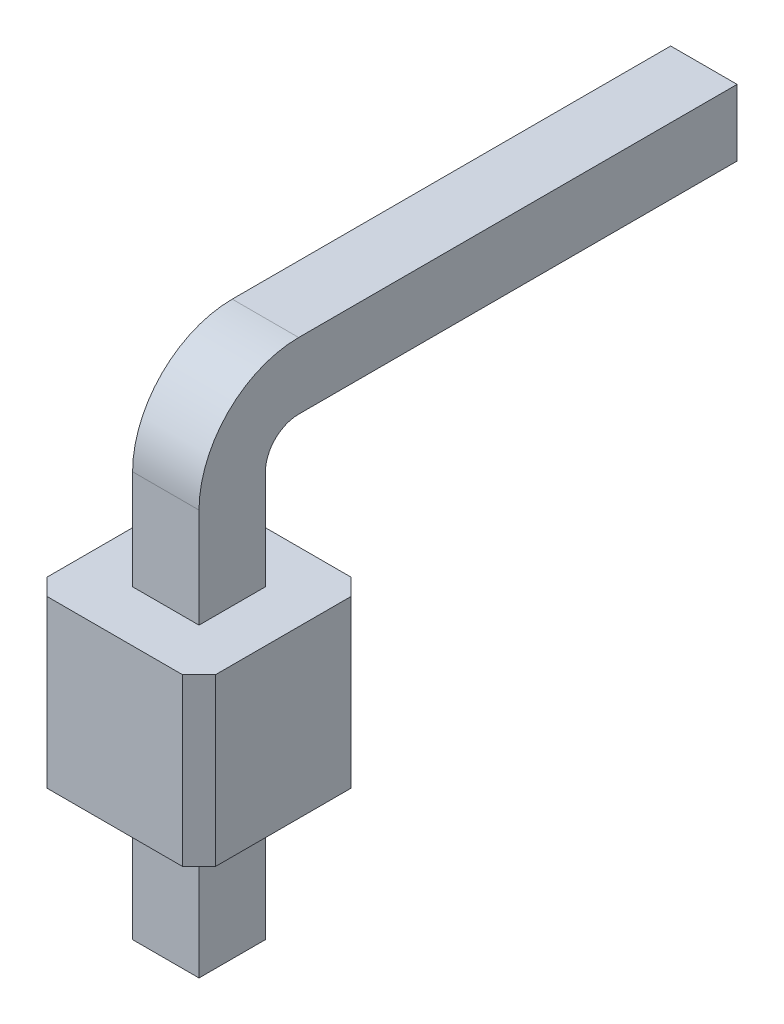
from build123d import *

# Parameters (mm, degrees)
BOSS_EXTRUDE1_DEPTH      = 2.5
EXTRUDE_THIN1_DEPTH      = 0.5
EXTRUDE_THIN1_DEPTH_BACK = 0.5
CHAMFER1_SIZE            = 0.4


with BuildPart() as part:
    # Sketch1 → Boss-Extrude1 (new body)
    with BuildSketch(Plane(origin=(0, 0, 0), x_dir=(-1, 0, 0), z_dir=(0, 1, 0))):
        Polygon((-1.02, 1.27), (1.02, 1.27), (1.27, 1.02), (1.27, -1.02), (1.02, -1.27), (-1.02, -1.27), (-1.27, -1.02), (-1.27, 1.02), align=None)
    extrude(amount=BOSS_EXTRUDE1_DEPTH)

    # Sketch2 → Extrude-Thin1 (add, two sides: drawn at the far end of the back side and taken through both)
    with BuildSketch(Plane(origin=(0, 0, 0), x_dir=(0, 0, -1), z_dir=(1, 0, 0)).offset(-EXTRUDE_THIN1_DEPTH_BACK)):
        with BuildLine():
            Line((0.5, -2.5), (0.5, 0))
            Line((0.5, 0), (0.5, 4))
            ThreePointArc((0.5, 4), (0.646446609, 4.353553391), (1, 4.5))
            Line((1, 4.5), (8, 4.5))
            Line((8, 4.5), (8, 5.5))
            Line((8, 5.5), (1, 5.5))
            ThreePointArc((1, 5.5), (-0.060660172, 5.060660172), (-0.5, 4))
            Line((-0.5, 4), (-0.5, 0))
            Line((-0.5, 0), (-0.5, -2.5))
            Line((-0.5, -2.5), (0.5, -2.5))
        make_face()
    extrude(amount=EXTRUDE_THIN1_DEPTH + EXTRUDE_THIN1_DEPTH_BACK)

    # Chamfer1
    chamfer1_edges = [part.edges().sort_by_distance(p)[0] for p in [
        (-0.5, 5, -8),
        (0, 4.5, -8),
        (0, -2.5, -0.5),
        (0.5, -2.5, 0),
        (0, -2.5, 0.5),
        (0, 5.5, -8),
        (0.5, 5, -8),
        (-0.5, -2.5, 0),
    ]]
    chamfer(chamfer1_edges, length=CHAMFER1_SIZE)


solid = part.part
